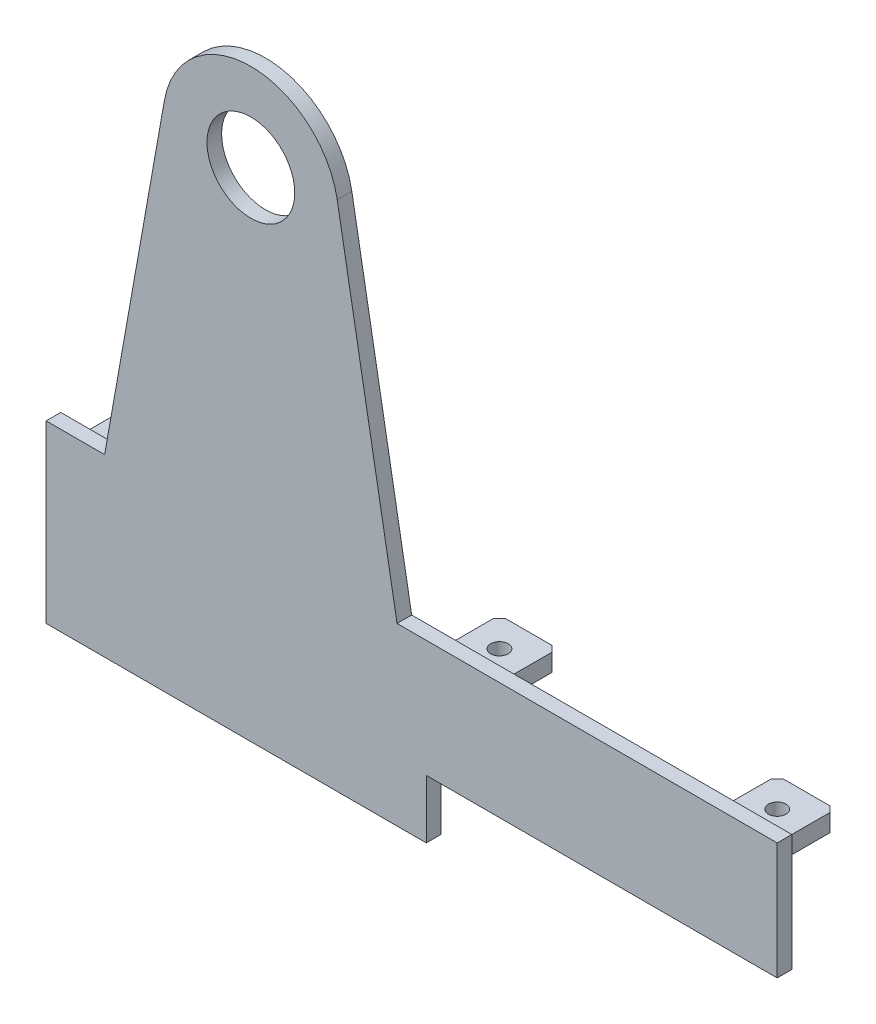
from build123d import *

# Parameters (mm, degrees)
EXTRUDE_1_DEPTH = 5
SKETCH_2_R      = 15
EXTRUDE_2_DEPTH = 5
SKETCH_3_W      = 20
SKETCH_3_H      = 20
SKETCH_3_R      = 3
EXTRUDE_3_DEPTH = 6
CHAMFER_1_SIZE  = 2
SKETCH_4_W      = 20
SKETCH_4_H      = 20
SKETCH_4_R      = 3
EXTRUDE_4_DEPTH = 6
CHAMFER_2_SIZE  = 2


with BuildPart() as part:
    # Эскиз1 → Бобышка-Вытянуть1 (new body)
    with BuildSketch(Plane.XY):
        Polygon((-65, 0), (-65, 60), (185, 60), (185, 20), (65, 20), (65, 0), align=None)
    extrude(amount=-EXTRUDE_1_DEPTH)

    # Эскиз2 → Бобышка-Вытянуть2 (add)
    with BuildSketch(Plane.XY):
        with BuildLine():
            Line((-45, 60), (-24.538020346, 175.244554703))
            ThreePointArc((-24.538020346, 175.244554703), (5, 200), (34.538020346, 175.244554703))
            Line((34.538020346, 175.244554703), (55, 60))
            Line((55, 60), (-45, 60))
        make_face()
        with Locations((5, 170)):
            Circle(SKETCH_2_R, mode=Mode.SUBTRACT)
    extrude(amount=-EXTRUDE_2_DEPTH)


with BuildPart() as body_2:
    # Эскиз3 → Бобышка-Вытянуть3 (new body)
    with BuildSketch(Plane(origin=(0, 55, 0), x_dir=(1, 0, 0), z_dir=(0, 1, 0))):
        with Locations((170, 15)):
            Rectangle(SKETCH_3_W, SKETCH_3_H)
        with Locations(Location((170, 15, 0), (0, 0, 270))):
            Circle(SKETCH_3_R, mode=Mode.SUBTRACT)
    extrude(amount=-EXTRUDE_3_DEPTH)

    # Фаска1
    chamfer_1_edges = [body_2.edges().sort_by_distance(p)[0] for p in [
        (160, 52, -25),
        (180, 52, -25),
        (180, 52, -5),
        (160, 52, -5),
    ]]
    chamfer(chamfer_1_edges, length=CHAMFER_1_SIZE)


with BuildPart() as body_3:
    # Зеркальное отражение1: mirrored copy
    add(body_2.part.mirror(Plane(origin=(60, 0, 0), x_dir=(0, 0, 1), z_dir=(1, 0, 0))))


with BuildPart() as body_4:
    # Эскиз4 → Бобышка-Вытянуть4 (new body)
    with BuildSketch(Plane(origin=(0, 55, 0), x_dir=(1, 0, 0), z_dir=(0, 1, 0))):
        with Locations((75, 15)):
            Rectangle(SKETCH_4_W, SKETCH_4_H)
        with Locations(Location((75, 15, 0), (0, 0, 270))):
            Circle(SKETCH_4_R, mode=Mode.SUBTRACT)
    extrude(amount=-EXTRUDE_4_DEPTH)

    # Фаска2
    chamfer_2_edges = [body_4.edges().sort_by_distance(p)[0] for p in [
        (85, 52, -5),
        (65, 52, -5),
        (85, 52, -25),
        (65, 52, -25),
    ]]
    chamfer(chamfer_2_edges, length=CHAMFER_2_SIZE)


solid = Compound([part.part, body_2.part, body_3.part, body_4.part])
